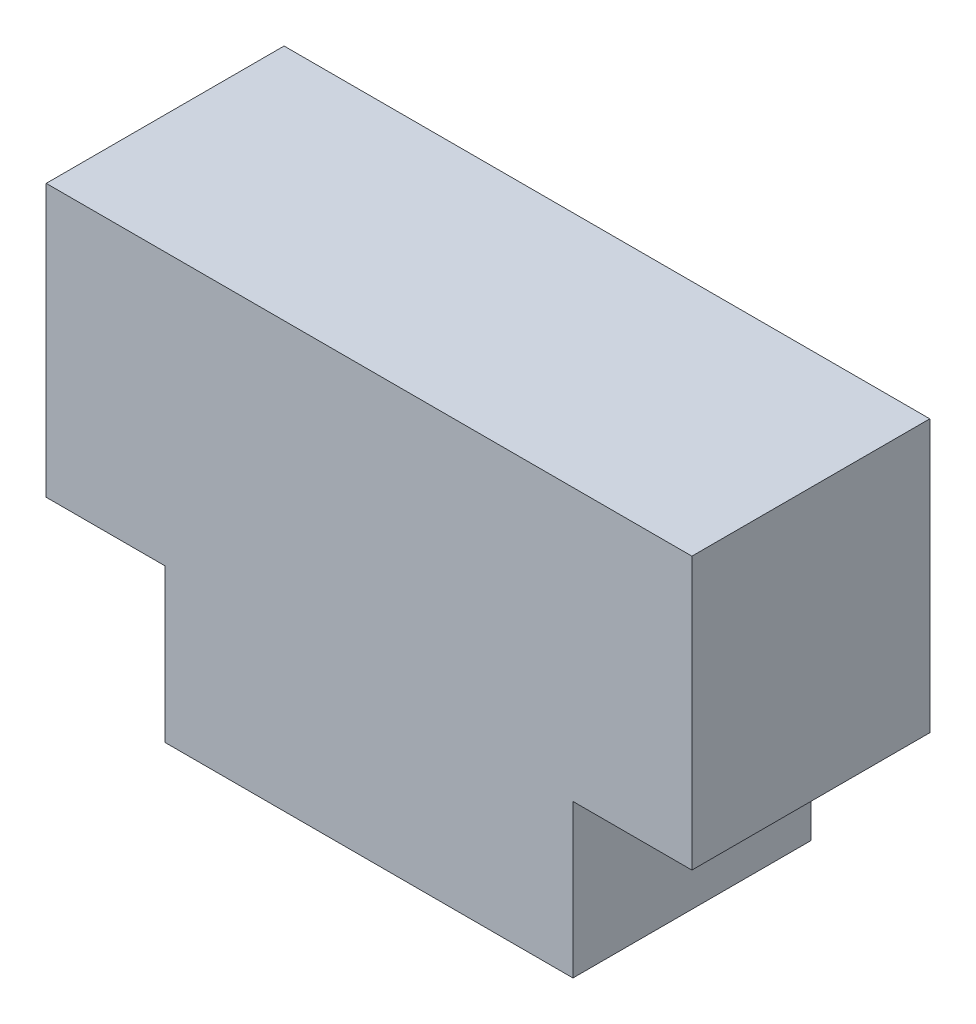
from build123d import *

# Parameters (mm, degrees)
COMPONENT_OUTLINE_DEPTH = 0.7


with BuildPart() as part:
    # 草图1 → Component_Outline (new body)
    with BuildSketch(Plane.XY):
        Polygon((0.95, 0.4), (-0.95, 0.4), (-0.95, -0.4), (-0.6, -0.4), (-0.6, -0.85), (0.6, -0.85), (0.6, -0.4), (0.95, -0.4), align=None)
    extrude(amount=COMPONENT_OUTLINE_DEPTH)


solid = part.part
